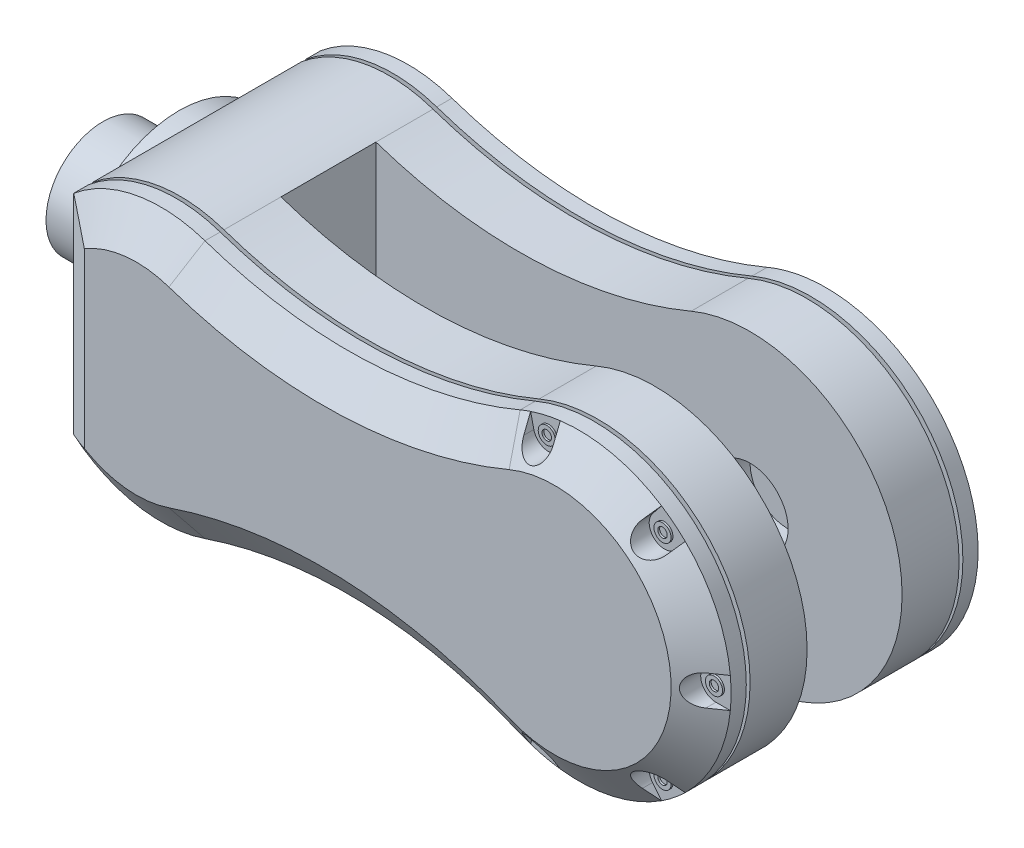
from build123d import *

# Parameters (mm, degrees)
SKETCH1_R                 = 27.5
BOSS_EXTRUDE1_DEPTH       = 5
BOSS_EXTRUDE2_DEPTH       = 15
BOSS_EXTRUDE3_DEPTH       = 1
BOSS_EXTRUDE5_DEPTH       = 4
BOSS_EXTRUDE6_DEPTH       = 6.5
BOSS_EXTRUDE6_TAPER       = 55
CUT_EXTRUDE1_DEPTH        = 6.5
SKETCH8_R                 = 2.25
SKETCH8_R_2               = 1.25
BOSS_EXTRUDE7_DEPTH       = 0.5
CIRPATTERN1_COUNT         = 7
BOSS_EXTRUDE9_START       = 40
BOSS_EXTRUDE9_DEPTH       = 40
MIRROR2_COPY_1_DEPTH      = 6.5
MIRROR2_COPY_2_DEPTH      = 6.5
MIRROR2_COPY_3_DEPTH      = 6.5
MIRROR2_COPY_4_DEPTH      = 6.5
MIRROR2_COPY_5_SKETCH_R   = 2.25
MIRROR2_COPY_5_SKETCH_R_2 = 1.25
MIRROR2_COPY_5_DEPTH      = 0.5
MIRROR2_COPY_6_SKETCH_R   = 2.25
MIRROR2_COPY_6_SKETCH_R_2 = 1.25
MIRROR2_COPY_6_DEPTH      = 0.5
MIRROR2_COPY_7_SKETCH_R   = 2.25
MIRROR2_COPY_7_SKETCH_R_2 = 1.25
MIRROR2_COPY_7_DEPTH      = 0.5
MIRROR2_COPY_8_SKETCH_R   = 2.25
MIRROR2_COPY_8_SKETCH_R_2 = 1.25
MIRROR2_COPY_8_DEPTH      = 0.5
SKETCH11_R                = 15
BOSS_EXTRUDE10_DEPTH      = 20
SKETCH12_R                = 10
CUT_EXTRUDE2_DEPTH        = 10
CUT_EXTRUDE3_START        = -10
SKETCH13_R                = 10
CUT_EXTRUDE3_DEPTH        = 10


with BuildPart() as part:
    # Sketch1 → Boss-Extrude1 (new body)
    with BuildSketch(Plane(origin=(0, 0, 0), x_dir=(0, 0, -1), z_dir=(1, 0, 0))):
        Circle(SKETCH1_R)
    extrude(amount=BOSS_EXTRUDE1_DEPTH)

    # Sketch2 → Boss-Extrude2 (add)
    with BuildSketch(Plane.XY.offset(12.7)):
        with BuildLine():
            Line((5, 27.5), (5, -27.5))
            ThreePointArc((5, -27.5), (21.425118567, -35.242317378), (39.537008186, -33.943297455))
            ThreePointArc((39.537008186, -33.943297455), (81.282064491, -27.797027102), (122.490033285, -36.870597127))
            ThreePointArc((122.490033285, -36.870597127), (178, 0), (122.490033285, 36.870597127))
            ThreePointArc((122.490033285, 36.870597127), (81.282064491, 27.797027102), (39.537008186, 33.943297455))
            ThreePointArc((39.537008186, 33.943297455), (21.425118567, 35.242317378), (5, 27.5))
        make_face()
    boss_extrude2 = extrude(amount=BOSS_EXTRUDE2_DEPTH)

    # Sketch3 → Boss-Extrude3 (add)
    with BuildSketch(Plane.XY.offset(27.7)):
        with BuildLine():
            Line((7.5, 26.305856426), (7.5, -26.305856426))
            ThreePointArc((7.5, -26.305856426), (22.450634838, -32.885447064), (38.732483447, -31.576286694))
            ThreePointArc((38.732483447, -31.576286694), (81.370231219, -25.29858226), (123.459406205, -34.566184807))
            ThreePointArc((123.459406205, -34.566184807), (175.5, 0), (123.459406205, 34.566184807))
            ThreePointArc((123.459406205, 34.566184807), (81.370231219, 25.29858226), (38.732483447, 31.576286694))
            ThreePointArc((38.732483447, 31.576286694), (22.450634838, 32.885447064), (7.5, 26.305856426))
        make_face()
    boss_extrude3 = extrude(amount=BOSS_EXTRUDE3_DEPTH)

    # Sketch5 → Boss-Extrude5 (add)
    with BuildSketch(Plane.XY.offset(28.7)):
        with BuildLine():
            Line((5, 27.5), (5, -27.5))
            ThreePointArc((5, -27.5), (21.425118567, -35.242317378), (39.537008186, -33.943297455))
            ThreePointArc((39.537008186, -33.943297455), (81.282064491, -27.797027102), (122.490033285, -36.870597127))
            ThreePointArc((122.490033285, -36.870597127), (178, 0), (122.490033285, 36.870597127))
            ThreePointArc((122.490033285, 36.870597127), (81.282064491, 27.797027102), (39.537008186, 33.943297455))
            ThreePointArc((39.537008186, 33.943297455), (21.425118567, 35.242317378), (5, 27.5))
        make_face()
    boss_extrude5 = extrude(amount=BOSS_EXTRUDE5_DEPTH)

    # Sketch6 → Boss-Extrude6 (add)
    with BuildSketch(Plane.XY.offset(32.7)):
        with BuildLine():
            Line((5, 27.5), (5, -27.5))
            ThreePointArc((5, -27.5), (21.425118567, -35.242317378), (39.537008186, -33.943297455))
            ThreePointArc((39.537008186, -33.943297455), (81.282064491, -27.797027102), (122.490033285, -36.870597127))
            ThreePointArc((122.490033285, -36.870597127), (178, 0), (122.490033285, 36.870597127))
            ThreePointArc((122.490033285, 36.870597127), (81.282064491, 27.797027102), (39.537008186, 33.943297455))
            ThreePointArc((39.537008186, 33.943297455), (21.425118567, 35.242317378), (5, 27.5))
        make_face()
    boss_extrude6 = extrude(amount=BOSS_EXTRUDE6_DEPTH, taper=BOSS_EXTRUDE6_TAPER)

    # Sketch7 → Cut-Extrude1 (cut)
    with BuildSketch(Plane.XY.offset(39.2)):
        with BuildLine():
            Line((174, 4), (179.423580677, 4))
            Line((179.423580677, 4), (179.423580677, -4))
            Line((179.423580677, -4), (174, -4))
            ThreePointArc((174, -4), (170, 0), (174, 4))
        make_face()
    cut_extrude1 = extrude(amount=-CUT_EXTRUDE1_DEPTH, mode=Mode.SUBTRACT)

    # Sketch8 → Boss-Extrude7 (add)
    with BuildSketch(Plane.XY.offset(32.7)):
        with Locations((174, 0)):
            Circle(SKETCH8_R)
        with Locations((174, 0)):
            Circle(SKETCH8_R_2, mode=Mode.SUBTRACT)
    boss_extrude7 = extrude(amount=BOSS_EXTRUDE7_DEPTH)

    # CirPattern1: Cut-Extrude1, Boss-Extrude7 ×7 about axis, 2 skipped
    cirpattern1_axis = Axis((138, 0, 0), (0, 0, -1))
    add([cut_extrude1.rotate(cirpattern1_axis, i * 360 / CIRPATTERN1_COUNT) for i in range(1, CIRPATTERN1_COUNT) if i not in (3, 4)], mode=Mode.SUBTRACT)
    add([boss_extrude7.rotate(cirpattern1_axis, i * 360 / CIRPATTERN1_COUNT) for i in range(1, CIRPATTERN1_COUNT) if i not in (3, 4)])

    # Sketch9 → Boss-Extrude9 (add)
    with BuildSketch(Plane(origin=(0, 0, 12.7), x_dir=(-1, 0, 0), z_dir=(0, 0, -1)).offset(BOSS_EXTRUDE9_START)):
        with BuildLine():
            Line((-39.537008186, 33.943297455), (-39.537008186, -33.943297455))
            ThreePointArc((-39.537008186, -33.943297455), (-21.425118567, -35.242317378), (-5, -27.5))
            Line((-5, -27.5), (-5, -24.391801901))
            Line((-5, -24.391801901), (-5, 24.391801901))
            Line((-5, 24.391801901), (-5, 27.5))
            ThreePointArc((-5, 27.5), (-21.425118567, 35.242317378), (-39.537008186, 33.943297455))
        make_face()
    boss_extrude9 = extrude(amount=-BOSS_EXTRUDE9_DEPTH)

    # Mirror2: Boss-Extrude2, Boss-Extrude3, Boss-Extrude5, Boss-Extrude6, Cut-Extrude1, Boss-Extrude7, Boss-Extrude9 across plane
    add(boss_extrude2.mirror(Plane(origin=(0, 0, 0.2), x_dir=(1, 0, 0), z_dir=(0, 0, -1))))
    add(boss_extrude3.mirror(Plane(origin=(0, 0, 0.2), x_dir=(1, 0, 0), z_dir=(0, 0, -1))))
    add(boss_extrude5.mirror(Plane(origin=(0, 0, 0.2), x_dir=(1, 0, 0), z_dir=(0, 0, -1))))
    add(boss_extrude6.mirror(Plane(origin=(0, 0, 0.2), x_dir=(1, 0, 0), z_dir=(0, 0, -1))))
    add(cut_extrude1.mirror(Plane(origin=(0, 0, 0.2), x_dir=(1, 0, 0), z_dir=(0, 0, -1))), mode=Mode.SUBTRACT)
    add(boss_extrude7.mirror(Plane(origin=(0, 0, 0.2), x_dir=(1, 0, 0), z_dir=(0, 0, -1))))
    add(boss_extrude9.mirror(Plane(origin=(0, 0, 0.2), x_dir=(1, 0, 0), z_dir=(0, 0, -1))))

    # Mirror2 copy 1 sketch → Mirror2 copy 1 (cut)
    with BuildSketch(Plane(origin=(51.958407343, 107.892744581, -38.8), x_dir=(0.6234898018587336, -0.7818314824680298, 0), z_dir=(0, 0, -1))):
        with BuildLine():
            Line((174, -4), (179.423580677, -4))
            Line((179.423580677, -4), (179.423580677, 4))
            Line((179.423580677, 4), (174, 4))
            ThreePointArc((174, 4), (170, 0), (174, -4))
        make_face()
    extrude(amount=-MIRROR2_COPY_1_DEPTH, mode=Mode.SUBTRACT)

    # Mirror2 copy 2 sketch → Mirror2 copy 2 (cut)
    with BuildSketch(Plane(origin=(168.707888886, 134.540051881, -38.8), x_dir=(-0.22252093395631434, -0.9749279121818236, 0), z_dir=(0, 0, -1))):
        with BuildLine():
            Line((174, -4), (179.423580677, -4))
            Line((179.423580677, -4), (179.423580677, 4))
            Line((179.423580677, 4), (174, 4))
            ThreePointArc((174, 4), (170, 0), (174, -4))
        make_face()
    extrude(amount=-MIRROR2_COPY_2_DEPTH, mode=Mode.SUBTRACT)

    # Mirror2 copy 3 sketch → Mirror2 copy 3 (cut)
    with BuildSketch(Plane(origin=(168.707888886, -134.540051881, -38.8), x_dir=(-0.2225209339563137, 0.9749279121818237, 0), z_dir=(0, 0, -1))):
        with BuildLine():
            Line((174, -4), (179.423580677, -4))
            Line((179.423580677, -4), (179.423580677, 4))
            Line((179.423580677, 4), (174, 4))
            ThreePointArc((174, 4), (170, 0), (174, -4))
        make_face()
    extrude(amount=-MIRROR2_COPY_3_DEPTH, mode=Mode.SUBTRACT)

    # Mirror2 copy 4 sketch → Mirror2 copy 4 (cut)
    with BuildSketch(Plane(origin=(51.958407343, -107.892744581, -38.8), x_dir=(0.6234898018587334, 0.7818314824680299, 0), z_dir=(0, 0, -1))):
        with BuildLine():
            Line((174, -4), (179.423580677, -4))
            Line((179.423580677, -4), (179.423580677, 4))
            Line((179.423580677, 4), (174, 4))
            ThreePointArc((174, 4), (170, 0), (174, -4))
        make_face()
    extrude(amount=-MIRROR2_COPY_4_DEPTH, mode=Mode.SUBTRACT)

    # Mirror2 copy 5 sketch → Mirror2 copy 5 (add)
    with BuildSketch(Plane(origin=(51.958407343, 107.892744581, -32.3), x_dir=(0.6234898018587336, -0.7818314824680298, 0), z_dir=(0, 0, -1))):
        with Locations((174, 0)):
            Circle(MIRROR2_COPY_5_SKETCH_R)
        with Locations((174, 0)):
            Circle(MIRROR2_COPY_5_SKETCH_R_2, mode=Mode.SUBTRACT)
    extrude(amount=MIRROR2_COPY_5_DEPTH)

    # Mirror2 copy 6 sketch → Mirror2 copy 6 (add)
    with BuildSketch(Plane(origin=(168.707888886, 134.540051881, -32.3), x_dir=(-0.22252093395631434, -0.9749279121818236, 0), z_dir=(0, 0, -1))):
        with Locations((174, 0)):
            Circle(MIRROR2_COPY_6_SKETCH_R)
        with Locations((174, 0)):
            Circle(MIRROR2_COPY_6_SKETCH_R_2, mode=Mode.SUBTRACT)
    extrude(amount=MIRROR2_COPY_6_DEPTH)

    # Mirror2 copy 7 sketch → Mirror2 copy 7 (add)
    with BuildSketch(Plane(origin=(168.707888886, -134.540051881, -32.3), x_dir=(-0.2225209339563137, 0.9749279121818237, 0), z_dir=(0, 0, -1))):
        with Locations((174, 0)):
            Circle(MIRROR2_COPY_7_SKETCH_R)
        with Locations((174, 0)):
            Circle(MIRROR2_COPY_7_SKETCH_R_2, mode=Mode.SUBTRACT)
    extrude(amount=MIRROR2_COPY_7_DEPTH)

    # Mirror2 copy 8 sketch → Mirror2 copy 8 (add)
    with BuildSketch(Plane(origin=(51.958407343, -107.892744581, -32.3), x_dir=(0.6234898018587334, 0.7818314824680299, 0), z_dir=(0, 0, -1))):
        with Locations((174, 0)):
            Circle(MIRROR2_COPY_8_SKETCH_R)
        with Locations((174, 0)):
            Circle(MIRROR2_COPY_8_SKETCH_R_2, mode=Mode.SUBTRACT)
    extrude(amount=MIRROR2_COPY_8_DEPTH)

    # Sketch11 → Boss-Extrude10 (add)
    with BuildSketch(Plane.ZY):
        Circle(SKETCH11_R)
    extrude(amount=BOSS_EXTRUDE10_DEPTH)

    # Sketch12 → Cut-Extrude2 (cut)
    with BuildSketch(Plane.XY.offset(-12.3)):
        with Locations((138, 0)):
            Circle(SKETCH12_R)
    extrude(amount=-CUT_EXTRUDE2_DEPTH, mode=Mode.SUBTRACT)

    # Sketch13 → Cut-Extrude3 (cut)
    with BuildSketch(Plane(origin=(0, 0, 12.7), x_dir=(-1, 0, 0), z_dir=(0, 0, -1)).offset(CUT_EXTRUDE3_START)):
        with Locations(Location((-138, 0, 0), (0, 0, 180))):
            Circle(SKETCH13_R)
    extrude(amount=CUT_EXTRUDE3_DEPTH, mode=Mode.SUBTRACT)


solid = part.part
